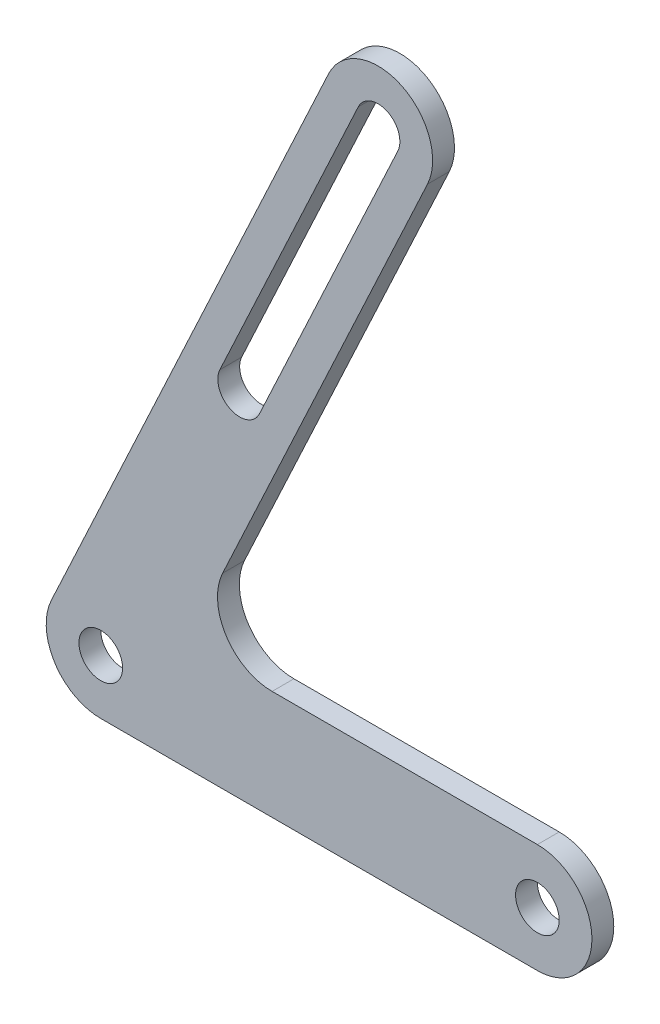
from build123d import *

# Parameters (mm, degrees)
BOSS_EXTRUDE1_DEPTH     = 2
CUT_EXTRUDE1_DEPTH      = 150.177687816
CUT_EXTRUDE1_DEPTH_BACK = 150.177687816
CUT_EXTRUDE2_DEPTH      = 150.177687816
CUT_EXTRUDE2_DEPTH_BACK = 150.177687816
SKETCH4_R               = 4
FILLET2_R               = 10


with BuildPart() as part:
    # Sketch2 → Boss-Extrude1 (new, symmetric)
    with BuildSketch(Plane.XY):
        with BuildLine():
            ThreePointArc((0, 10), (-5.372996083, 8.433914458), (-9.06307787, 4.226182617))
            ThreePointArc((-9.06307787, 4.226182617), (-8.433914458, -5.372996083), (0, -10))
            ThreePointArc((0, -10), (5.372996083, -8.433914458), (9.06307787, -4.226182617))
            Line((9.06307787, -4.226182617), (15.696855771, 10))
            Line((15.696855771, 10), (0, 10))
        make_face()
        with BuildLine():
            Line((41.742866429, 113.179881771), (-9.06307787, 4.226182617))
            ThreePointArc((-9.06307787, 4.226182617), (-5.372996083, 8.433914458), (0, 10))
            Line((0, 10), (15.696855771, 10))
            Line((15.696855771, 10), (59.86902217, 104.727516536))
            ThreePointArc((59.86902217, 104.727516536), (55.032126917, 118.016777024), (41.742866429, 113.179881771))
        make_face()
        with BuildLine():
            ThreePointArc((9.06307787, -4.226182617), (5.372996083, -8.433914458), (0, -10))
            Line((0, -10), (80, -10))
            ThreePointArc((80, -10), (90, 0), (80, 10))
            Line((80, 10), (15.696855771, 10))
            Line((15.696855771, 10), (9.06307787, -4.226182617))
        make_face()
    extrude(amount=BOSS_EXTRUDE1_DEPTH, both=True)

    # Sketch3 → Cut-Extrude1 (cut, two sides: drawn at the far end of the back side and taken through both)
    with BuildSketch(Plane.XY.offset(-CUT_EXTRUDE1_DEPTH_BACK)):
        with BuildLine():
            Line((54.431175448, 107.263226106), (29.074079743, 52.884758884))
            ThreePointArc((29.074079743, 52.884758884), (23.758375548, 50.950000783), (21.823617447, 56.265704978))
            Line((21.823617447, 56.265704978), (47.180713151, 110.6441722))
            ThreePointArc((47.180713151, 110.6441722), (52.496417346, 112.578930301), (54.431175448, 107.263226106))
        make_face()
    extrude(amount=CUT_EXTRUDE1_DEPTH + CUT_EXTRUDE1_DEPTH_BACK, mode=Mode.SUBTRACT)

    # Sketch4 → Cut-Extrude2 (cut, two sides: drawn at the far end of the back side and taken through both)
    with BuildSketch(Plane.XY.offset(-CUT_EXTRUDE2_DEPTH_BACK)):
        with Locations((80, 0)):
            Circle(SKETCH4_R)
        Circle(SKETCH4_R)
    extrude(amount=CUT_EXTRUDE2_DEPTH + CUT_EXTRUDE2_DEPTH_BACK, mode=Mode.SUBTRACT)

    # Fillet2
    fillet2_edges = [part.edges().sort_by_distance(p)[0] for p in [
        (15.696855771, 10, 0),
    ]]
    fillet(fillet2_edges, radius=FILLET2_R)


solid = part.part
